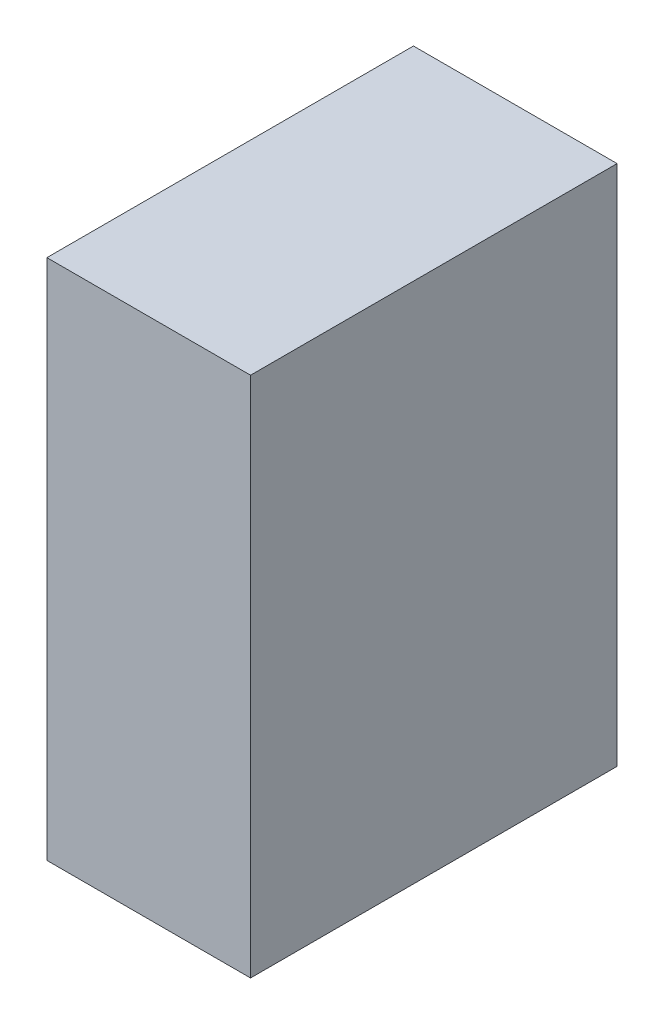
from build123d import *

# Parameters (mm, degrees)
SKETCH_1_W      = 18
SKETCH_1_H      = 25.635414884
EXTRUDE_1_DEPTH = 10


with BuildPart() as part:
    # Эскиз1 → Вытянуть1 (new body)
    with BuildSketch(Plane(origin=(0, 0, 0), x_dir=(0, 0, -1), z_dir=(1, 0, 0))):
        Rectangle(SKETCH_1_W, SKETCH_1_H)
    extrude(amount=-EXTRUDE_1_DEPTH)


solid = part.part
